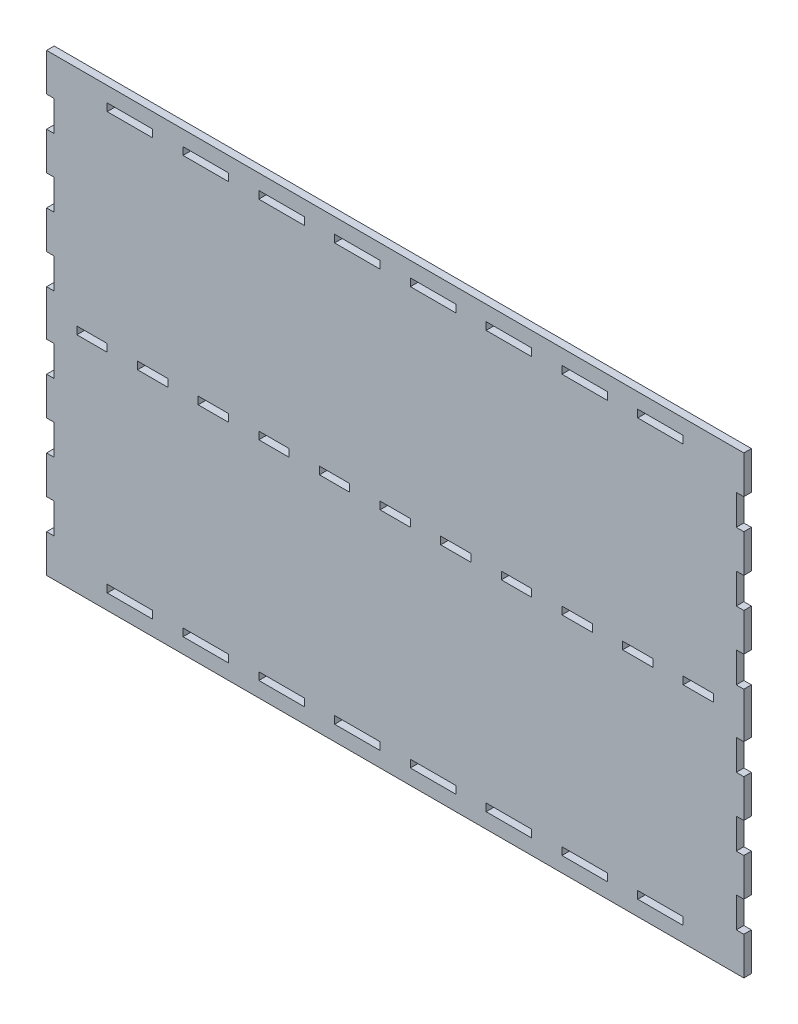
from build123d import *

# Parameters (mm, degrees)
SKETCH1_W           = 30
SKETCH1_H           = 5
SKETCH1_W_2         = 20
BOSS_EXTRUDE1_DEPTH = 5


with BuildPart() as part:
    # Sketch1 → Boss-Extrude1 (new body)
    with BuildSketch(Plane.XY):
        Polygon((84.753464523, -219.784412909), (-375.246535477, -219.784412909), (-375.246535477, -194.784412909), (-370.246535477, -194.784412909), (-370.246535477, -174.784412909), (-375.246535477, -174.784412909), (-375.246535477, -149.784412909), (-370.246535477, -149.784412909), (-370.246535477, -129.784412909), (-375.246535477, -129.784412909), (-375.246535477, -104.784412909), (-370.246535477, -104.784412909), (-370.246535477, -84.784412909), (-375.246535477, -84.784412909), (-375.246535477, -54.784412909), (-370.246535477, -54.784412909), (-370.246535477, -34.784412909), (-375.246535477, -34.784412909), (-375.246535477, -9.784412909), (-370.246535477, -9.784412909), (-370.246535477, 10.215587091), (-375.246535477, 10.215587091), (-375.246535477, 35.215587091), (-370.246535477, 35.215587091), (-370.246535477, 55.215587091), (-375.246535477, 55.215587091), (-375.246535477, 80.215587091), (84.753464523, 80.215587091), (84.753464523, 55.215587091), (79.753464523, 55.215587091), (79.753464523, 35.215587091), (84.753464523, 35.215587091), (84.753464523, 10.215587091), (79.753464523, 10.215587091), (79.753464523, -9.784412909), (84.753464523, -9.784412909), (84.753464523, -34.784412909), (79.753464523, -34.784412909), (79.753464523, -54.784412909), (84.753464523, -54.784412909), (84.753464523, -84.784412909), (79.753464523, -84.784412909), (79.753464523, -104.784412909), (84.753464523, -104.784412909), (84.753464523, -129.784412909), (79.753464523, -129.784412909), (79.753464523, -149.784412909), (84.753464523, -149.784412909), (84.753464523, -174.784412909), (79.753464523, -174.784412909), (79.753464523, -194.784412909), (84.753464523, -194.784412909), align=None)
        with Locations((-70.246535477, -207.284412909)):
            Rectangle(SKETCH1_W, SKETCH1_H, mode=Mode.SUBTRACT)
        with Locations((-120.246535477, -207.284412909)):
            Rectangle(SKETCH1_W, SKETCH1_H, mode=Mode.SUBTRACT)
        with Locations((-20.246535477, -207.284412909)):
            Rectangle(SKETCH1_W, SKETCH1_H, mode=Mode.SUBTRACT)
        with Locations((29.753464523, -207.284412909)):
            Rectangle(SKETCH1_W, SKETCH1_H, mode=Mode.SUBTRACT)
        with Locations((-320.246535477, -207.284412909)):
            Rectangle(SKETCH1_W, SKETCH1_H, mode=Mode.SUBTRACT)
        with Locations((-270.246535477, -207.284412909)):
            Rectangle(SKETCH1_W, SKETCH1_H, mode=Mode.SUBTRACT)
        with Locations((-220.246535477, -207.284412909)):
            Rectangle(SKETCH1_W, SKETCH1_H, mode=Mode.SUBTRACT)
        with Locations((-170.246535477, -207.284412909)):
            Rectangle(SKETCH1_W, SKETCH1_H, mode=Mode.SUBTRACT)
        with Locations((-220.246535477, 67.715587091)):
            Rectangle(SKETCH1_W, SKETCH1_H, mode=Mode.SUBTRACT)
        with Locations((-170.246535477, 67.715587091)):
            Rectangle(SKETCH1_W, SKETCH1_H, mode=Mode.SUBTRACT)
        with Locations((-270.246535477, 67.715587091)):
            Rectangle(SKETCH1_W, SKETCH1_H, mode=Mode.SUBTRACT)
        with Locations((-320.246535477, 67.715587091)):
            Rectangle(SKETCH1_W, SKETCH1_H, mode=Mode.SUBTRACT)
        with Locations((29.753464523, 67.715587091)):
            Rectangle(SKETCH1_W, SKETCH1_H, mode=Mode.SUBTRACT)
        with Locations((-20.246535477, 67.715587091)):
            Rectangle(SKETCH1_W, SKETCH1_H, mode=Mode.SUBTRACT)
        with Locations((-70.246535477, 67.715587091)):
            Rectangle(SKETCH1_W, SKETCH1_H, mode=Mode.SUBTRACT)
        with Locations((-120.246535477, 67.715587091)):
            Rectangle(SKETCH1_W, SKETCH1_H, mode=Mode.SUBTRACT)
        with Locations((-185.246535477, -69.784412909)):
            Rectangle(SKETCH1_W_2, SKETCH1_H, mode=Mode.SUBTRACT)
        with Locations((-145.246535477, -69.784412909)):
            Rectangle(SKETCH1_W_2, SKETCH1_H, mode=Mode.SUBTRACT)
        with Locations((-225.246535477, -69.784412909)):
            Rectangle(SKETCH1_W_2, SKETCH1_H, mode=Mode.SUBTRACT)
        with Locations((-265.246535477, -69.784412909)):
            Rectangle(SKETCH1_W_2, SKETCH1_H, mode=Mode.SUBTRACT)
        with Locations((-305.246535477, -69.784412909)):
            Rectangle(SKETCH1_W_2, SKETCH1_H, mode=Mode.SUBTRACT)
        with Locations((-345.246535477, -69.784412909)):
            Rectangle(SKETCH1_W_2, SKETCH1_H, mode=Mode.SUBTRACT)
        with Locations((54.753464523, -69.784412909)):
            Rectangle(SKETCH1_W_2, SKETCH1_H, mode=Mode.SUBTRACT)
        with Locations((14.753464523, -69.784412909)):
            Rectangle(SKETCH1_W_2, SKETCH1_H, mode=Mode.SUBTRACT)
        with Locations((-25.246535477, -69.784412909)):
            Rectangle(SKETCH1_W_2, SKETCH1_H, mode=Mode.SUBTRACT)
        with Locations((-65.246535477, -69.784412909)):
            Rectangle(SKETCH1_W_2, SKETCH1_H, mode=Mode.SUBTRACT)
        with Locations((-105.246535477, -69.784412909)):
            Rectangle(SKETCH1_W_2, SKETCH1_H, mode=Mode.SUBTRACT)
    extrude(amount=BOSS_EXTRUDE1_DEPTH)


solid = part.part
